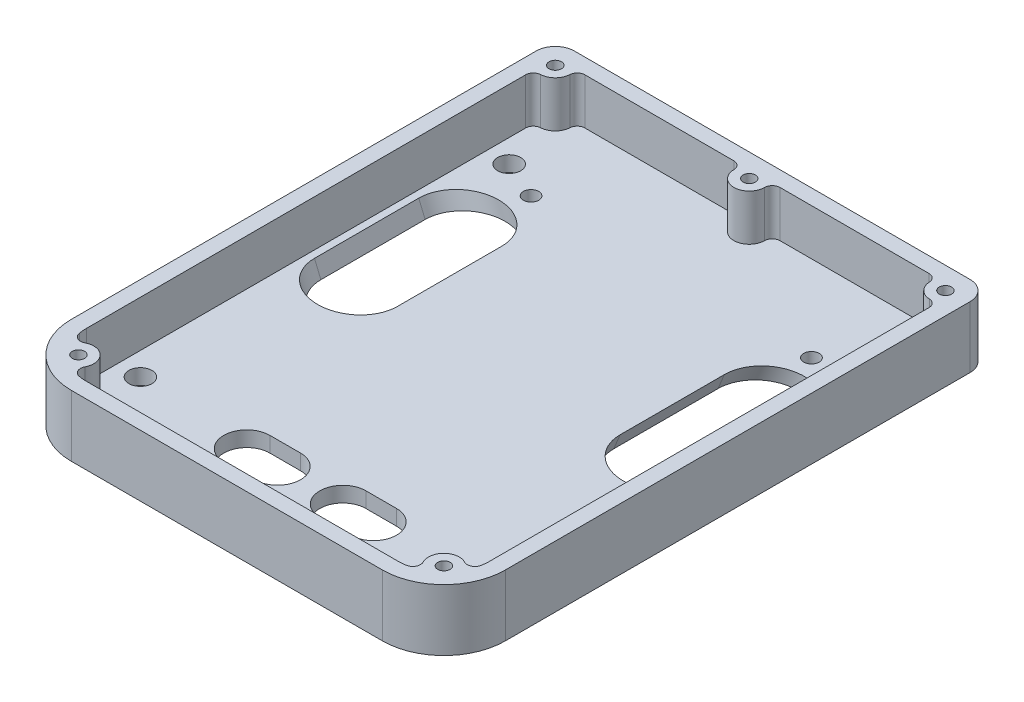
from build123d import *

# Parameters (mm, degrees)
BOSS_EXTRUDE1_DEPTH          = 6.35
BOSS_EXTRUDE2_DEPTH          = 19.05
CUT_EXTRUDE2_START           = -25.4
CUT_EXTRUDE2_DEPTH           = 31.75
CUT_EXTRUDE3_DEPTH           = 147.267687771
BOSS_EXTRUDE3_DEPTH          = 19.05
F_1_4_0_25_DIAMETER_HOLE1_D  = 6.35
F_3_8_0_375_DIAMETER_HOLE1_D = 9.525
F_1_4_20_TAPPED_HOLE1_D      = 5.1054
F_1_4_20_TAPPED_HOLE1_DEPTH  = 16.51
F_1_4_20_TAPPED_HOLE1_TIP    = 1.533816902


with BuildPart() as part:
    # Sketch1 → Boss-Extrude1 (new body)
    with BuildSketch(Plane(origin=(0, 0, 0), x_dir=(1, 0, 0), z_dir=(0, 1, 0))):
        with BuildLine():
            Line((-81.75625, 112.7125), (81.75625, 112.7125))
            ThreePointArc((81.75625, 112.7125), (87.368910076, 110.387660076), (89.69375, 104.775))
            Line((89.69375, 104.775), (89.69375, -87.3125))
            ThreePointArc((89.69375, -87.3125), (82.254262242, -105.273012242), (64.29375, -112.7125))
            Line((64.29375, -112.7125), (-64.29375, -112.7125))
            ThreePointArc((-64.29375, -112.7125), (-82.254262242, -105.273012242), (-89.69375, -87.3125))
            Line((-89.69375, -87.3125), (-89.69375, 104.775))
            ThreePointArc((-89.69375, 104.775), (-87.368910076, 110.387660076), (-81.75625, 112.7125))
        make_face()
    extrude(amount=BOSS_EXTRUDE1_DEPTH)

    # Sketch2 → Boss-Extrude2 (add)
    with BuildSketch(Plane(origin=(0, 6.35, 0), x_dir=(1, 0, 0), z_dir=(0, 1, 0))):
        with BuildLine():
            Line((89.69375, -87.3125), (89.69375, 104.775))
            ThreePointArc((89.69375, 104.775), (87.368910076, 110.387660076), (81.75625, 112.7125))
            Line((81.75625, 112.7125), (-81.75625, 112.7125))
            ThreePointArc((-81.75625, 112.7125), (-87.368910076, 110.387660076), (-89.69375, 104.775))
            Line((-89.69375, 104.775), (-89.69375, -87.3125))
            ThreePointArc((-89.69375, -87.3125), (-82.254262242, -105.273012242), (-64.29375, -112.7125))
            Line((-64.29375, -112.7125), (64.29375, -112.7125))
            ThreePointArc((64.29375, -112.7125), (82.254262242, -105.273012242), (89.69375, -87.3125))
        make_face()
        with BuildLine():
            Line((81.75625, 106.3625), (-81.75625, 106.3625))
            ThreePointArc((-81.75625, 106.3625), (-82.878782015, 105.897532015), (-83.34375, 104.775))
            Line((-83.34375, 104.775), (-83.34375, -87.3125))
            ThreePointArc((-83.34375, -87.3125), (-77.764134182, -100.782884182), (-64.29375, -106.3625))
            Line((-64.29375, -106.3625), (64.29375, -106.3625))
            ThreePointArc((64.29375, -106.3625), (77.764134182, -100.782884182), (83.34375, -87.3125))
            Line((83.34375, -87.3125), (83.34375, 104.775))
            ThreePointArc((83.34375, 104.775), (82.878782015, 105.897532015), (81.75625, 106.3625))
        make_face(mode=Mode.SUBTRACT)
    extrude(amount=BOSS_EXTRUDE2_DEPTH)

    # Sketch7 → Cut-Extrude2 (cut)
    with BuildSketch(Plane(origin=(13.135345572, 31.711529428, 0), x_dir=(0, 0, -1), z_dir=(0.3826834323650874, 0.9238795325112878, 0)).offset(CUT_EXTRUDE2_START)):
        with BuildLine():
            Line((46.94555, -40.046221701), (3.85445, -40.046221701))
            add(Edge.make_bspline(
                [(3.85445, -71.796221701), (-27.89555, -71.796221701), (-27.89555, -40.046221701), (3.85445, -40.046221701)],
                knots=[0, 0, 0, 0, 1, 1, 1, 1], degree=3, weights=[1, 0.333333333, 0.333333333, 1]))
            Line((3.85445, -71.796221701), (46.94555, -71.796221701))
            add(Edge.make_bspline(
                [(46.94555, -40.046221701), (78.69555, -40.046221701), (78.69555, -71.796221701), (46.94555, -71.796221701)],
                knots=[0, 0, 0, 0, 1, 1, 1, 1], degree=3, weights=[1, 0.333333333, 0.333333333, 1]))
        make_face()
    cut_extrude2 = extrude(amount=CUT_EXTRUDE2_DEPTH, mode=Mode.SUBTRACT)

    # Sketch8 → Cut-Extrude3 (cut, through all)
    with BuildSketch(Plane.XZ):
        with BuildLine():
            Line((13.49375, 87.78875), (26.19375, 87.78875))
            ThreePointArc((26.19375, 87.78875), (35.71875, 78.26375), (26.19375, 68.73875))
            Line((26.19375, 68.73875), (13.49375, 68.73875))
            ThreePointArc((13.49375, 68.73875), (3.96875, 78.26375), (13.49375, 87.78875))
        make_face()
        with BuildLine():
            Line((-13.49375, 87.78875), (-26.19375, 87.78875))
            ThreePointArc((-26.19375, 87.78875), (-35.71875, 78.26375), (-26.19375, 68.73875))
            Line((-26.19375, 68.73875), (-13.49375, 68.73875))
            ThreePointArc((-13.49375, 68.73875), (-3.96875, 78.26375), (-13.49375, 87.78875))
        make_face()
    extrude(amount=-CUT_EXTRUDE3_DEPTH, mode=Mode.SUBTRACT)

    # Sketch9 → Boss-Extrude3 (add)
    with BuildSketch(Plane(origin=(0, 6.35, 0), x_dir=(1, 0, 0), z_dir=(0, 1, 0))):
        with BuildLine():
            Line((-81.75625, 106.3625), (-71.120073585, 106.3625))
            ThreePointArc((-71.120073585, 106.3625), (-73.309655038, 105.486708137), (-74.291288385, 103.342489328))
            ThreePointArc((-74.291288385, 103.342489328), (-76.143589924, 99.162339924), (-80.323739328, 97.310038385))
            ThreePointArc((-80.323739328, 97.310038385), (-82.467958137, 96.328405038), (-83.34375, 94.138823585))
            Line((-83.34375, 94.138823585), (-83.34375, 104.775))
            ThreePointArc((-83.34375, 104.775), (-82.878782015, 105.897532015), (-81.75625, 106.3625))
        make_face()
        with BuildLine():
            Line((-9.525, 106.3625), (9.525, 106.3625))
            ThreePointArc((9.525, 106.3625), (7.27993597, 105.43256403), (6.35, 103.1875))
            ThreePointArc((6.35, 103.1875), (0, 96.8375), (-6.35, 103.1875))
            ThreePointArc((-6.35, 103.1875), (-7.27993597, 105.43256403), (-9.525, 106.3625))
        make_face()
        with BuildLine():
            Line((83.34375, 104.775), (83.34375, 94.138823585))
            ThreePointArc((83.34375, 94.138823585), (82.467958137, 96.328405038), (80.323739328, 97.310038385))
            ThreePointArc((80.323739328, 97.310038385), (76.143589924, 99.162339924), (74.291288385, 103.342489328))
            ThreePointArc((74.291288385, 103.342489328), (73.309655038, 105.486708137), (71.120073585, 106.3625))
            Line((71.120073585, 106.3625), (81.75625, 106.3625))
            ThreePointArc((81.75625, 106.3625), (82.878782015, 105.897532015), (83.34375, 104.775))
        make_face()
        with BuildLine():
            ThreePointArc((-83.049421546, -90.648258512), (-81.324581361, -92.941426622), (-78.45534091, -92.907472557))
            ThreePointArc((-78.45534091, -92.907472557), (-71.028942091, -94.047692091), (-69.888722557, -101.47409091))
            ThreePointArc((-69.888722557, -101.47409091), (-69.922676622, -104.343331361), (-67.629508512, -106.068171546))
            ThreePointArc((-67.629508512, -106.068171546), (-77.764134182, -100.782884182), (-83.049421546, -90.648258512))
        make_face()
        with BuildLine():
            ThreePointArc((69.888722557, -101.47409091), (69.922676622, -104.343331361), (67.629508512, -106.068171546))
            ThreePointArc((67.629508512, -106.068171546), (77.764134182, -100.782884182), (83.049421546, -90.648258512))
            ThreePointArc((83.049421546, -90.648258512), (81.324581361, -92.941426622), (78.45534091, -92.907472557))
            ThreePointArc((78.45534091, -92.907472557), (71.028942091, -94.047692091), (69.888722557, -101.47409091))
        make_face()
    extrude(amount=BOSS_EXTRUDE3_DEPTH)

    # 1/4 (0.25) Diameter Hole1 (through all)
    with Locations(Plane(origin=(0, 6.35, 0), x_dir=(1, 0, 0), z_dir=(0, 1, 0))):
        with Locations((-57.94375, 70.96125), (-57.94375, -94.13875), (57.94375, -94.13875), (57.94375, 70.96125)):
            Hole(F_1_4_0_25_DIAMETER_HOLE1_D / 2)

    # 3/8 (0.375) Diameter Hole1 (through all)
    with Locations(Plane(origin=(0, 0, 0), x_dir=(-1, 0, 0), z_dir=(0, -1, 0))):
        with Locations((-73.81875, 77.7875), (73.81875, 77.7875), (73.81875, -74.6125), (-73.81875, -74.6125)):
            Hole(F_3_8_0_375_DIAMETER_HOLE1_D / 2)

    # Mirror1: Cut-Extrude2 across plane
    add(cut_extrude2.mirror(Plane(origin=(0, 0, 0), x_dir=(0, 0, 1), z_dir=(1, 0, 0))), mode=Mode.SUBTRACT)

    # 1/4-20 Tapped Hole1
    with Locations(Plane(origin=(0, 25.4, 0), x_dir=(1, 0, 0), z_dir=(0, 1, 0))):
        with Locations((-75.519070151, -98.537820151), (75.519070151, -98.537820151), (80.633717985, 103.652467985), (0, 103.1875), (-80.633717985, 103.652467985)):
            Hole(F_1_4_20_TAPPED_HOLE1_D / 2, depth=F_1_4_20_TAPPED_HOLE1_DEPTH)
            with Locations((0, 0, -(F_1_4_20_TAPPED_HOLE1_DEPTH + F_1_4_20_TAPPED_HOLE1_TIP / 2))):  # 118° drill point
                Cone(0, F_1_4_20_TAPPED_HOLE1_D / 2, F_1_4_20_TAPPED_HOLE1_TIP, mode=Mode.SUBTRACT)


solid = part.part
